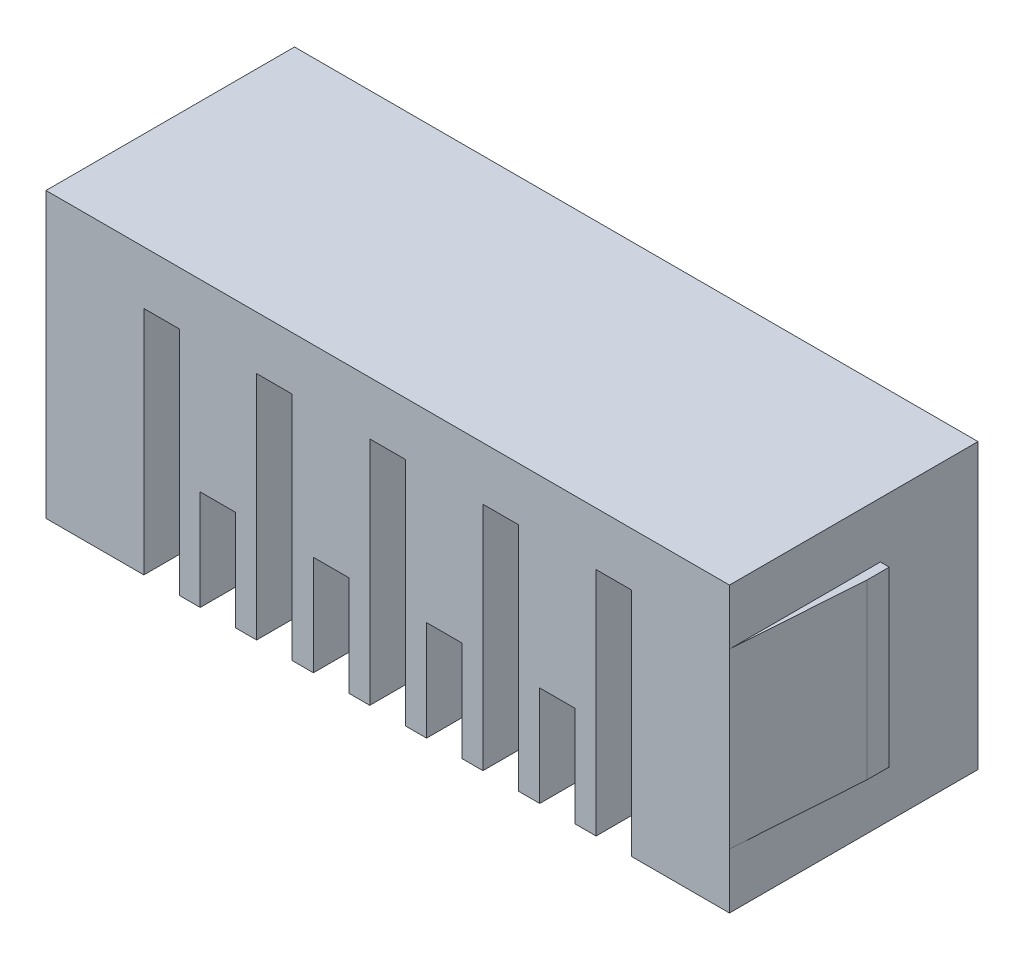
from build123d import *

# Parameters (mm, degrees)
SKETCH1_W           = 15.4
SKETCH1_H           = 6.4
BOSS_EXTRUDE1_DEPTH = 5.6
SKETCH2_W           = 0.8
SKETCH2_H           = 4.8
SKETCH2_H_2         = 1.9
CUT_EXTRUDE1_DEPTH  = 5.2
SKETCH3_W           = 3.4
SKETCH3_H           = 3.9
BOSS_EXTRUDE2_DEPTH = 0.2
CUT_EXTRUDE2_REACH  = 12.968
SKETCH5_W           = 0.8
SKETCH5_H           = 2.945
BOSS_EXTRUDE3_DEPTH = 1.9


with BuildPart() as part:
    # Sketch1 → Boss-Extrude1 (new body)
    with BuildSketch(Plane.XY):
        Rectangle(SKETCH1_W, SKETCH1_H)
    extrude(amount=BOSS_EXTRUDE1_DEPTH)

    # Sketch2 → Cut-Extrude1 (cut)
    with BuildSketch(Plane.XZ.offset(3.2)):
        with Locations((5.095, 3.2)):
            Rectangle(SKETCH2_W, SKETCH2_H)
        with Locations((2.545, 3.2)):
            Rectangle(SKETCH2_W, SKETCH2_H)
        with Locations((-0.005, 3.2)):
            Rectangle(SKETCH2_W, SKETCH2_H)
        with Locations((-2.555, 3.2)):
            Rectangle(SKETCH2_W, SKETCH2_H)
        with Locations((-5.095, 3.2)):
            Rectangle(SKETCH2_W, SKETCH2_H)
        with Locations((3.825, 4.65)):
            Rectangle(SKETCH2_W, SKETCH2_H_2)
        with Locations((1.275, 4.65)):
            Rectangle(SKETCH2_W, SKETCH2_H_2)
        with Locations((-1.275, 4.65)):
            Rectangle(SKETCH2_W, SKETCH2_H_2)
        with Locations((-3.825, 4.65)):
            Rectangle(SKETCH2_W, SKETCH2_H_2)
    extrude(amount=-CUT_EXTRUDE1_DEPTH, mode=Mode.SUBTRACT)

    # Sketch3 → Boss-Extrude2 (add)
    with BuildSketch(Plane(origin=(7.7, 0, 0), x_dir=(0, 0, -1), z_dir=(1, 0, 0))):
        with Locations((-3.9, 0)):
            Rectangle(SKETCH3_W, SKETCH3_H)
    boss_extrude2 = extrude(amount=BOSS_EXTRUDE2_DEPTH)

    # Sketch4 → Cut-Extrude2 (cut, up to next)
    with BuildSketch(Plane(origin=(0, 1.95, 0), x_dir=(1, 0, 0), z_dir=(0, 1, 0)), mode=Mode.PRIVATE) as cut_extrude2_sk1:
        Polygon((7.9, -2.7), (7.7, -5.6), (7.9, -5.6), align=None)
    cut_extrude2_tool1 = extrude(cut_extrude2_sk1.sketch, amount=-CUT_EXTRUDE2_REACH, mode=Mode.PRIVATE) & part.part
    cut_extrude2 = cut_extrude2_tool1.solids().sort_by_distance((7.833333, 1.95, 4.633333))[0]
    add(cut_extrude2, mode=Mode.SUBTRACT)

    # Mirror1: Boss-Extrude2, Cut-Extrude2 across plane
    add(boss_extrude2.mirror(Plane(origin=(0, 0, 0), x_dir=(0, 0, 1), z_dir=(1, 0, 0))))
    add(cut_extrude2.mirror(Plane(origin=(0, 0, 0), x_dir=(0, 0, 1), z_dir=(1, 0, 0))), mode=Mode.SUBTRACT)

    # Sketch5 → Boss-Extrude3 (add)
    with BuildSketch(Plane.XY.offset(3.7)):
        with Locations((-3.825, 0.5275)):
            Rectangle(SKETCH5_W, SKETCH5_H)
        with Locations((-1.275, 0.5275)):
            Rectangle(SKETCH5_W, SKETCH5_H)
        with Locations((1.275, 0.5275)):
            Rectangle(SKETCH5_W, SKETCH5_H)
        with Locations((3.825, 0.5275)):
            Rectangle(SKETCH5_W, SKETCH5_H)
    extrude(amount=BOSS_EXTRUDE3_DEPTH)


solid = part.part
